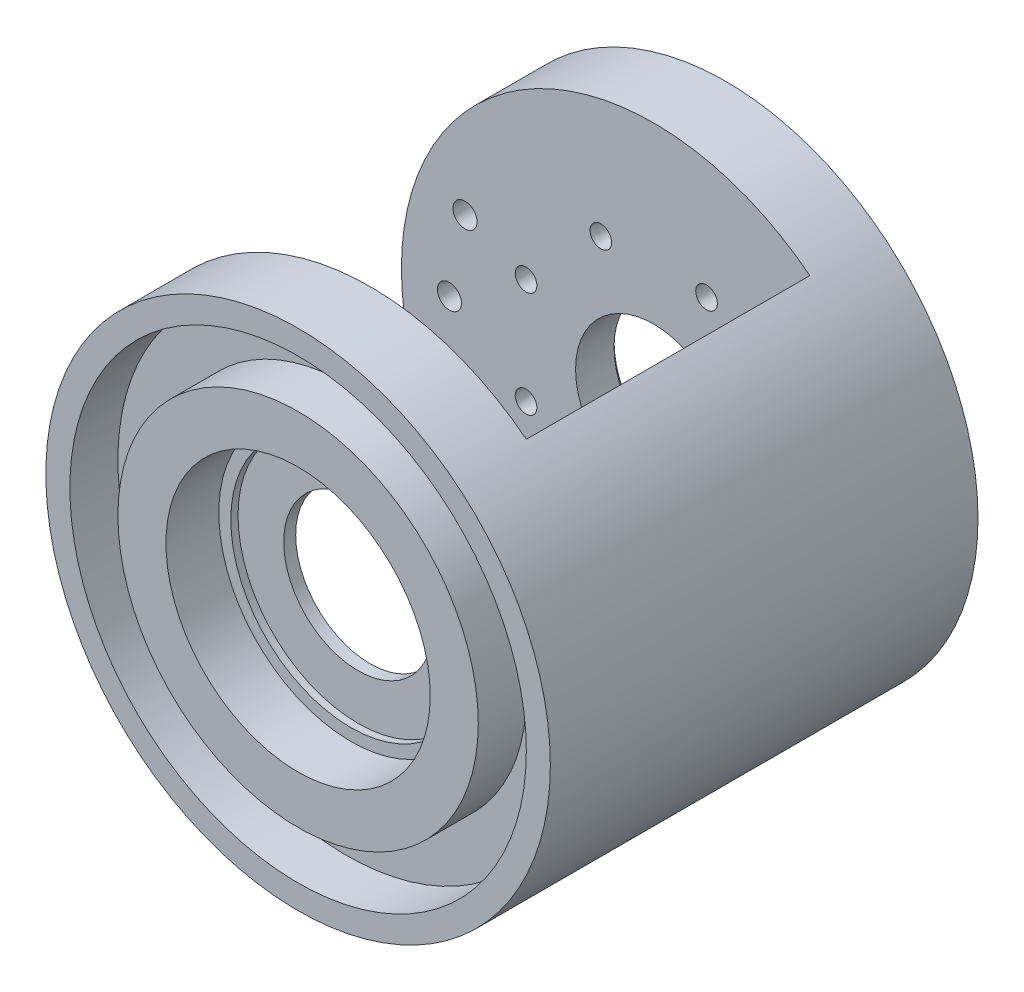
from build123d import *

# Parameters (mm, degrees)
SKETCH_1_R           = 105
EXTRUDE_1_DEPTH      = 178
SKETCH_2_R           = 95
SKETCH_2_R_2         = 75
CUT_EXTRUDE_1_DEPTH  = 20
SKETCH_3_R           = 55
CUT_EXTRUDE_2_DEPTH  = 22
SKETCH_4_R           = 50
CUT_EXTRUDE_3_DEPTH  = 3
SKETCH_5_R           = 31
CUT_EXTRUDE_4_DEPTH  = 23
CUT_EXTRUDE_START    = -20
SKETCH_6_R           = 95
SKETCH_6_R_2         = 75
CUT_EXTRUDE_5_DEPTH  = 20
SKETCH_7_R           = 67.5
CUT_EXTRUDE_6_DEPTH  = 12
SKETCH_8_R           = 32.5
CUT_EXTRUDE_7_DEPTH  = 20
SKETCH_9_R           = 4.5
CUT_EXTRUDE_8_DEPTH  = 30
CUT_EXTRUDE_9_DEPTH  = 118
SKETCH_11_R          = 5
CUT_EXTRUDE_10_DEPTH = 50
CHAMFER_1_SIZE       = 2


with BuildPart() as part:
    # 草图1 → 拉伸1 (new body)
    with BuildSketch(Plane.XY):
        Circle(SKETCH_1_R)
    extrude(amount=EXTRUDE_1_DEPTH)

    # 草图2 → 切除-拉伸1 (cut)
    with BuildSketch(Plane.XY.offset(178)):
        Circle(SKETCH_2_R)
        Circle(SKETCH_2_R_2, mode=Mode.SUBTRACT)
    extrude(amount=-CUT_EXTRUDE_1_DEPTH, mode=Mode.SUBTRACT)

    # 草图3 → 切除-拉伸2 (cut)
    with BuildSketch(Plane.XY.offset(178)):
        Circle(SKETCH_3_R)
    extrude(amount=-CUT_EXTRUDE_2_DEPTH, mode=Mode.SUBTRACT)

    # 草图4 → 切除-拉伸3 (cut)
    with BuildSketch(Plane.XY.offset(156)):
        Circle(SKETCH_4_R)
    extrude(amount=-CUT_EXTRUDE_3_DEPTH, mode=Mode.SUBTRACT)

    # 草图5 → 切除-拉伸4 (cut)
    with BuildSketch(Plane.XY.offset(153)):
        Circle(SKETCH_5_R)
    extrude(amount=-CUT_EXTRUDE_4_DEPTH, mode=Mode.SUBTRACT)

    # 草图6 → 切除-拉伸5 (cut)
    with BuildSketch(Plane(origin=(0, 0, 0), x_dir=(-1, 0, 0), z_dir=(0, 0, -1)).offset(CUT_EXTRUDE_START)):
        with Locations(Location((0, 0, 0), (0, 0, 180))):
            Circle(SKETCH_6_R)
        with Locations(Location((0, 0, 0), (0, 0, 180))):
            Circle(SKETCH_6_R_2, mode=Mode.SUBTRACT)
    extrude(amount=CUT_EXTRUDE_5_DEPTH, mode=Mode.SUBTRACT)

    # 草图7 → 切除-拉伸6 (cut)
    with BuildSketch(Plane(origin=(0, 0, 0), x_dir=(-1, 0, 0), z_dir=(0, 0, -1))):
        Circle(SKETCH_7_R)
    extrude(amount=-CUT_EXTRUDE_6_DEPTH, mode=Mode.SUBTRACT)

    # 草图8 → 切除-拉伸7 (cut)
    with BuildSketch(Plane(origin=(0, 0, 12), x_dir=(-1, 0, 0), z_dir=(0, 0, -1))):
        Circle(SKETCH_8_R)
    extrude(amount=-CUT_EXTRUDE_7_DEPTH, mode=Mode.SUBTRACT)

    # 草图9 → 切除-拉伸8 (cut)
    with BuildSketch(Plane(origin=(0, 0, 12), x_dir=(-1, 0, 0), z_dir=(0, 0, -1))):
        with Locations((53.123073119, 22.004297361)):
            Circle(SKETCH_9_R)
        with Locations((53.123073119, -22.004297361)):
            Circle(SKETCH_9_R)
        with Locations((22.004297361, -53.123073119)):
            Circle(SKETCH_9_R)
        with Locations((-22.004297361, -53.123073119)):
            Circle(SKETCH_9_R)
        with Locations((-53.123073119, -22.004297361)):
            Circle(SKETCH_9_R)
        with Locations((-53.123073119, 22.004297361)):
            Circle(SKETCH_9_R)
        with Locations((-22.004297361, 53.123073119)):
            Circle(SKETCH_9_R)
        with Locations((22.004297361, 53.123073119)):
            Circle(SKETCH_9_R)
    extrude(amount=-CUT_EXTRUDE_8_DEPTH, mode=Mode.SUBTRACT)

    # 草图10 → 切除-拉伸9 (cut)
    with BuildSketch(Plane(origin=(0, 0, 30), x_dir=(-1, 0, 0), z_dir=(0, 0, -1))):
        with BuildLine():
            Line((-65, 0), (-65, 82.462112512))
            ThreePointArc((-65, 82.462112512), (105, 0), (-65, -82.462112512))
            Line((-65, -82.462112512), (-65, 0))
        make_face()
    extrude(amount=-CUT_EXTRUDE_9_DEPTH, mode=Mode.SUBTRACT)

    # 草图11 → 切除-拉伸10 (cut)
    with BuildSketch(Plane(origin=(0, 0, 0), x_dir=(-1, 0, 0), z_dir=(0, 0, -1))):
        with Locations((78.529760263, 32.528091751)):
            Circle(SKETCH_11_R)
        with Locations((85, 0)):
            Circle(SKETCH_11_R)
        with Locations((78.529760263, -32.528091751)):
            Circle(SKETCH_11_R)
    extrude(amount=-CUT_EXTRUDE_10_DEPTH, mode=Mode.SUBTRACT)

    # 倒角1
    chamfer_1_edges = [part.edges().sort_by_distance(p)[0] for p in [
        (32.5, 0, 12),
    ]]
    chamfer(chamfer_1_edges, length=CHAMFER_1_SIZE)


solid = part.part
